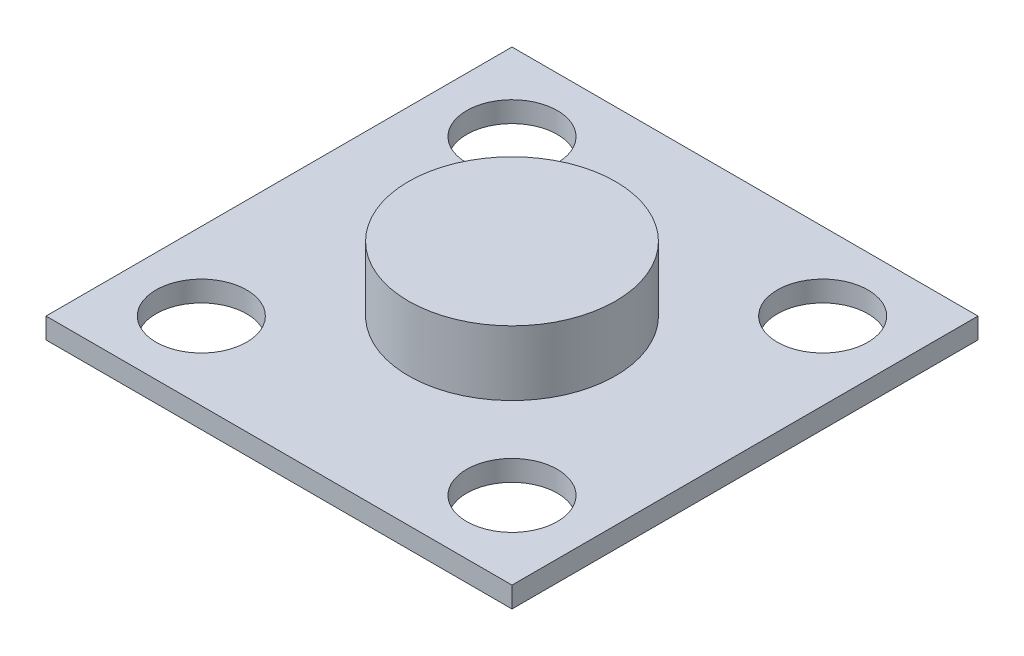
from build123d import *

# Parameters (mm, degrees)
SKETCH_1_W          = 18
SKETCH_1_H          = 18
EXTRUDE_1_DEPTH     = 0.8
SKETCH_2_R          = 1.75
CUT_EXTRUDE_1_DEPTH = 26.468411808
SKETCH_3_R          = 4
EXTRUDE_2_DEPTH     = 2.5


with BuildPart() as part:
    # 草图1 → 凸台-拉伸1 (new body)
    with BuildSketch(Plane(origin=(0, 0, 0), x_dir=(1, 0, 0), z_dir=(0, 1, 0))):
        with Locations((9, 9)):
            Rectangle(SKETCH_1_W, SKETCH_1_H)
    extrude(amount=EXTRUDE_1_DEPTH)

    # 草图2 → 切除-拉伸1 (cut, through all)
    with BuildSketch(Plane(origin=(0, 0.8, 0), x_dir=(1, 0, 0), z_dir=(0, 1, 0))):
        with Locations(Location((3, 15, 0), (0, 0, 270))):
            Circle(SKETCH_2_R)
        with Locations(Location((15, 15, 0), (0, 0, 270))):
            Circle(SKETCH_2_R)
        with Locations(Location((15, 3, 0), (0, 0, 270))):
            Circle(SKETCH_2_R)
        with Locations(Location((3, 3, 0), (0, 0, 270))):
            Circle(SKETCH_2_R)
    extrude(amount=-CUT_EXTRUDE_1_DEPTH, mode=Mode.SUBTRACT)

    # 草图3 → 凸台-拉伸2 (add)
    with BuildSketch(Plane(origin=(0, 0.8, 0), x_dir=(1, 0, 0), z_dir=(0, 1, 0))):
        with Locations(Location((9, 9, 0), (0, 0, 90))):
            Circle(SKETCH_3_R)
    extrude(amount=EXTRUDE_2_DEPTH)


solid = part.part
